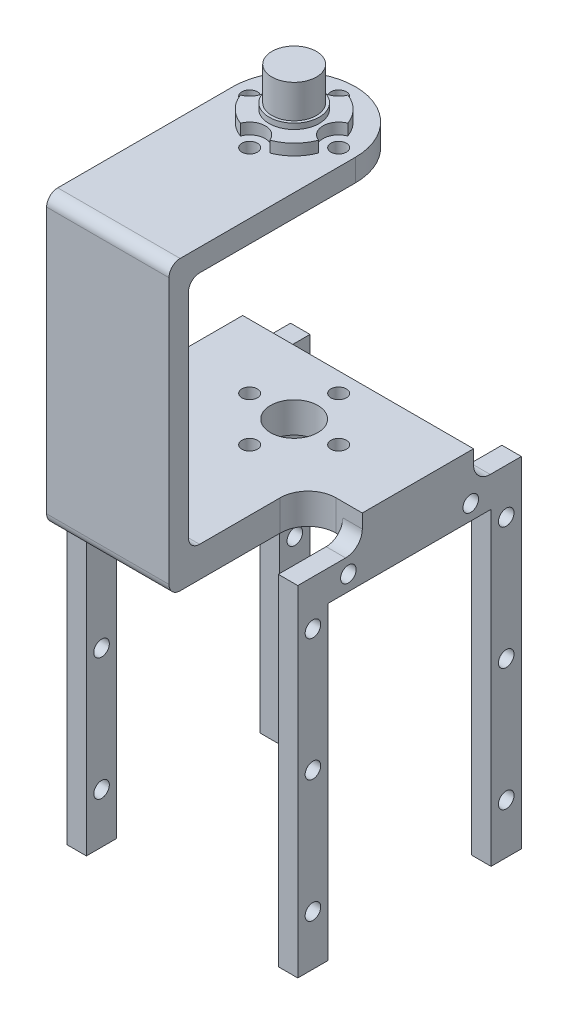
from build123d import *

# Parameters (mm, degrees)
SKETCH1_R           = 11
SKETCH1_R_2         = 4.25
BOSS_EXTRUDE1_DEPTH = 4
SKETCH2_R           = 1.4
CUT_EXTRUDE1_DEPTH  = 17.062378404
SKETCH3_R           = 7.5
BOSS_EXTRUDE2_DEPTH = 2
SKETCH4_R           = 2.811136831
CUT_EXTRUDE2_DEPTH  = 2
SKETCH5_R           = 4.5
BOSS_EXTRUDE3_DEPTH = 7
CUT_EXTRUDE3_START  = -6
SKETCH6_R           = 4.5
SKETCH6_R_2         = 4
CUT_EXTRUDE3_DEPTH  = 6
BOSS_EXTRUDE4_DEPTH = 4
SKETCH13_W          = 22
SKETCH13_H          = 3.5
BOSS_EXTRUDE5_DEPTH = 46.25
SKETCH14_W          = 22
SKETCH14_H          = 5.5
BOSS_EXTRUDE6_DEPTH = 45
CUT_EXTRUDE6_START  = -30
SKETCH16_R          = 4.25
SKETCH16_R_2        = 1.4
CUT_EXTRUDE6_DEPTH  = 30
SKETCH17_W          = 9.75
SKETCH17_H          = 5.5
BOSS_EXTRUDE7_DEPTH = 20
FILLET3_R           = 2
SKETCH19_R          = 2.5
CUT_EXTRUDE8_DEPTH  = 1.5
SKETCH21_W          = 3.5
SKETCH21_H          = 40.2
BOSS_EXTRUDE8_DEPTH = 61.1
SKETCH22_R          = 1.4
SKETCH22_W          = 29.3
SKETCH22_H          = 55.6
CUT_EXTRUDE10_DEPTH = 61.1
FILLET4_R           = 5
FILLET5_R           = 3


with BuildPart() as part:
    # Sketch1 → Boss-Extrude1 (new body)
    with BuildSketch(Plane(origin=(0, 0, 0), x_dir=(1, 0, 0), z_dir=(0, 1, 0))):
        with Locations(Location((0, 0, 0), (0, 0, 270))):
            Circle(SKETCH1_R)
        with Locations(Location((0, 0, 0), (0, 0, 270))):
            Circle(SKETCH1_R_2, mode=Mode.SUBTRACT)
    extrude(amount=BOSS_EXTRUDE1_DEPTH)

    # Sketch2 → Cut-Extrude1 (cut, through all)
    with BuildSketch(Plane(origin=(0, 4, 0), x_dir=(1, 0, 0), z_dir=(0, 1, 0))):
        with Locations(Location((0, 8, 0), (0, 0, 270))):
            Circle(SKETCH2_R)
        with Locations(Location((8, 0, 0), (0, 0, 270))):
            Circle(SKETCH2_R)
        with Locations(Location((0, -8, 0), (0, 0, 270))):
            Circle(SKETCH2_R)
        with Locations(Location((-8, 0, 0), (0, 0, 270))):
            Circle(SKETCH2_R)
    extrude(amount=-CUT_EXTRUDE1_DEPTH, mode=Mode.SUBTRACT)

    # Sketch3 → Boss-Extrude2 (add)
    with BuildSketch(Plane(origin=(0, 4, 0), x_dir=(1, 0, 0), z_dir=(0, 1, 0))):
        with Locations(Location((0, 0, 0), (0, 0, 80.315835906))):
            Circle(SKETCH3_R)
    extrude(amount=BOSS_EXTRUDE2_DEPTH)

    # Sketch4 → Cut-Extrude2 (cut)
    with BuildSketch(Plane(origin=(0, 6, 0), x_dir=(1, 0, 0), z_dir=(0, 1, 0))):
        with Locations((8, 0)):
            Circle(SKETCH4_R)
        with Locations((0, -8)):
            Circle(SKETCH4_R)
        with Locations((-8, 0)):
            Circle(SKETCH4_R)
        with Locations((0, 8)):
            Circle(SKETCH4_R)
    extrude(amount=-CUT_EXTRUDE2_DEPTH, mode=Mode.SUBTRACT)

    # Sketch5 → Boss-Extrude3 (add)
    with BuildSketch(Plane(origin=(0, 6, 0), x_dir=(1, 0, 0), z_dir=(0, 1, 0))):
        with Locations(Location((0, 0, 0), (0, 0, 270))):
            Circle(SKETCH5_R)
    extrude(amount=BOSS_EXTRUDE3_DEPTH)

    # Sketch6 → Cut-Extrude3 (cut)
    with BuildSketch(Plane(origin=(0, 13, 0), x_dir=(1, 0, 0), z_dir=(0, 1, 0)).offset(CUT_EXTRUDE3_START)):
        with Locations(Location((0, 0, 0), (0, 0, 270))):
            Circle(SKETCH6_R)
        with Locations(Location((0, 0, 0), (0, 0, 270))):
            Circle(SKETCH6_R_2, mode=Mode.SUBTRACT)
    extrude(amount=CUT_EXTRUDE3_DEPTH, mode=Mode.SUBTRACT)

    # Sketch8 → Boss-Extrude4 (add)
    with BuildSketch(Plane.XZ):
        with BuildLine():
            Line((11, 30), (-11, 30))
            Line((-11, 30), (-11, 0))
            ThreePointArc((-11, 0), (0, 11), (11, 0))
            Line((11, 0), (11, 30))
        make_face()
    extrude(amount=-BOSS_EXTRUDE4_DEPTH)

    # Sketch13 → Boss-Extrude5 (add)
    with BuildSketch(Plane(origin=(0, 4, 0), x_dir=(1, 0, 0), z_dir=(0, 1, 0))):
        with Locations((0, -31.75)):
            Rectangle(SKETCH13_W, SKETCH13_H)
    extrude(amount=-BOSS_EXTRUDE5_DEPTH)

    # Sketch14 → Boss-Extrude6 (add)
    with BuildSketch(Plane.XY.offset(33.5)):
        with Locations((0, -45)):
            Rectangle(SKETCH14_W, SKETCH14_H)
    extrude(amount=-BOSS_EXTRUDE6_DEPTH)

    # Sketch16 → Cut-Extrude6 (cut)
    with BuildSketch(Plane.XZ.offset(47.75).offset(CUT_EXTRUDE6_START)):
        with Locations(Location((0, 0, 0), (0, 0, 90))):
            Circle(SKETCH16_R)
        with Locations(Location((-8, 0, 0), (0, 0, 90))):
            Circle(SKETCH16_R_2)
        with Locations(Location((0, -8, 0), (0, 0, 90))):
            Circle(SKETCH16_R_2)
        with Locations(Location((8, 0, 0), (0, 0, 90))):
            Circle(SKETCH16_R_2)
        with Locations(Location((0, 8, 0), (0, 0, 90))):
            Circle(SKETCH16_R_2)
    extrude(amount=CUT_EXTRUDE6_DEPTH, mode=Mode.SUBTRACT)

    # Sketch17 → Boss-Extrude7 (add)
    with BuildSketch(Plane(origin=(0, 0, -11.5), x_dir=(-1, 0, 0), z_dir=(0, 0, -1))):
        with Locations((-15.875, -45)):
            Rectangle(SKETCH17_W, SKETCH17_H)
        with Locations((15.875, -45)):
            Rectangle(SKETCH17_W, SKETCH17_H)
    extrude(amount=-BOSS_EXTRUDE7_DEPTH)

    # Fillet3
    fillet3_edges = [part.edges().sort_by_distance(p)[0] for p in [
        (0, 0, 30),
        (0, -42.25, 30),
        (0, 4, 33.5),
        (0, -47.75, 33.5),
    ]]
    fillet(fillet3_edges, radius=FILLET3_R)

    # Sketch19 → Cut-Extrude8 (cut)
    with BuildSketch(Plane.XZ.offset(47.75)):
        with Locations((-8, 0)):
            Circle(SKETCH19_R)
        with Locations((0, 8)):
            Circle(SKETCH19_R)
        with Locations((8, 0)):
            Circle(SKETCH19_R)
        with Locations((0, -8)):
            Circle(SKETCH19_R)
    extrude(amount=-CUT_EXTRUDE8_DEPTH, mode=Mode.SUBTRACT)

    # Sketch21 → Boss-Extrude8 (add)
    with BuildSketch(Plane.XZ.offset(47.75)):
        with Locations((-19, 0)):
            Rectangle(SKETCH21_W, SKETCH21_H)
        with Locations((19, 0)):
            Rectangle(SKETCH21_W, SKETCH21_H)
    extrude(amount=BOSS_EXTRUDE8_DEPTH)

    # Sketch22 → Cut-Extrude10 (cut)
    with BuildSketch(Plane(origin=(20.75, 0, 0), x_dir=(0, 0, -1), z_dir=(1, 0, 0))):
        with Locations((-11, -50.5)):
            Circle(SKETCH22_R)
        with Locations((11, -50.5)):
            Circle(SKETCH22_R)
        with Locations((-17.375, -99.85)):
            Circle(SKETCH22_R)
        with Locations((-17.375, -77.85)):
            Circle(SKETCH22_R)
        with Locations((-17.375, -55.85)):
            Circle(SKETCH22_R)
        with Locations((17.375, -99.85)):
            Circle(SKETCH22_R)
        with Locations((17.375, -77.85)):
            Circle(SKETCH22_R)
        with Locations((17.375, -55.85)):
            Circle(SKETCH22_R)
        with Locations((0, -81.05)):
            Rectangle(SKETCH22_W, SKETCH22_H)
    extrude(amount=-CUT_EXTRUDE10_DEPTH, mode=Mode.SUBTRACT)

    # Fillet4
    fillet4_edges = [part.edges().sort_by_distance(p)[0] for p in [
        (11, -45, 8.5),
        (-11, -45, 8.5),
    ]]
    fillet(fillet4_edges, radius=FILLET4_R)

    # Fillet5
    fillet5_edges = [part.edges().sort_by_distance(p)[0] for p in [
        (-19, -47.75, -11.5),
        (19, -47.75, 8.5),
        (-19, -47.75, 8.5),
        (19, -47.75, -11.5),
    ]]
    fillet(fillet5_edges, radius=FILLET5_R)


solid = part.part
